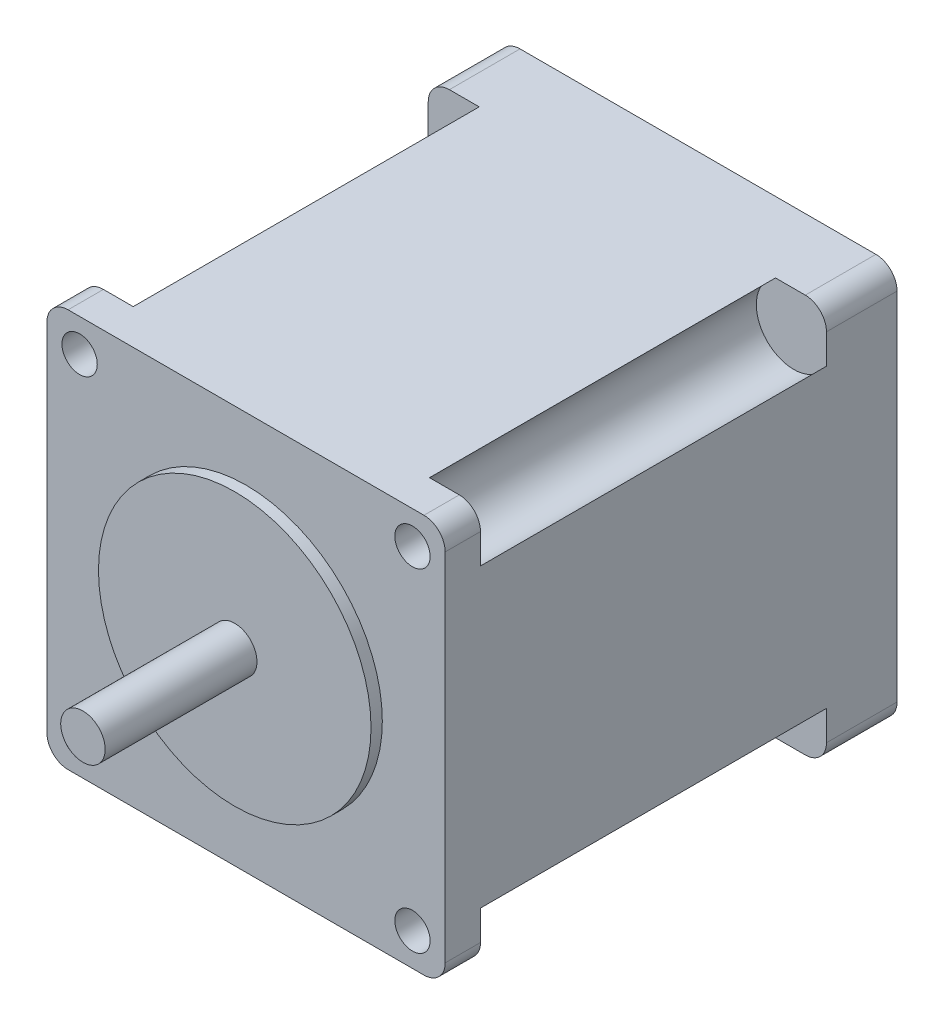
from build123d import *

# Parameters (mm, degrees)
SKETCH1_W          = 56.4
SKETCH1_H          = 56.4
EXTRUDE1_DEPTH     = 64
SKETCH2_R          = 19.3
EXTRUDE2_DEPTH     = 1.6
SKETCH3_R          = 3.15
EXTRUDE3_DEPTH     = 21.5
FILLET1_R          = 3
SKETCH4_R          = 2.5
CUT_EXTRUDE1_DEPTH = 6
SKETCH6_R          = 5.305168107
CUT_EXTRUDE2_DEPTH = 49


with BuildPart() as part:
    # Sketch1 → Extrude1 (new body)
    with BuildSketch(Plane.XY):
        with Locations((28.2, 28.2)):
            Rectangle(SKETCH1_W, SKETCH1_H)
    extrude(amount=EXTRUDE1_DEPTH)

    # Fillet1
    fillet1_edges = [part.edges().sort_by_distance(p)[0] for p in [
        (0, 56.4, 32),
        (56.4, 56.4, 32),
        (56.4, 0, 32),
        (0, 0, 32),
    ]]
    fillet(fillet1_edges, radius=FILLET1_R)

    # Sketch4 → Cut-Extrude1 (cut)
    with BuildSketch(Plane.XY.offset(64)):
        with Locations((4.63, 51.77)):
            Circle(SKETCH4_R)
        with Locations((51.77, 51.77)):
            Circle(SKETCH4_R)
        with Locations((51.77, 4.63)):
            Circle(SKETCH4_R)
        with Locations((4.63, 4.63)):
            Circle(SKETCH4_R)
    extrude(amount=-CUT_EXTRUDE1_DEPTH, mode=Mode.SUBTRACT)

    # Sketch6 → Cut-Extrude2 (cut)
    with BuildSketch(Plane.XY.offset(59)):
        with Locations((4.63, 51.77)):
            Circle(SKETCH6_R)
        with Locations((51.77, 51.77)):
            Circle(SKETCH6_R)
        with Locations((4.63, 4.63)):
            Circle(SKETCH6_R)
        with Locations((51.77, 4.63)):
            Circle(SKETCH6_R)
    extrude(amount=-CUT_EXTRUDE2_DEPTH, mode=Mode.SUBTRACT)


with BuildPart() as body_2:
    # Sketch2 → Extrude2 (new body)
    with BuildSketch(Plane.XY.offset(64)):
        with Locations((28.2, 28.2)):
            Circle(SKETCH2_R)
    extrude(amount=EXTRUDE2_DEPTH)

    # Sketch3 → Extrude3 (add)
    with BuildSketch(Plane.XY.offset(65.6)):
        with Locations((28.2, 28.2)):
            Circle(SKETCH3_R)
    extrude(amount=EXTRUDE3_DEPTH)


solid = Compound([part.part, body_2.part])
